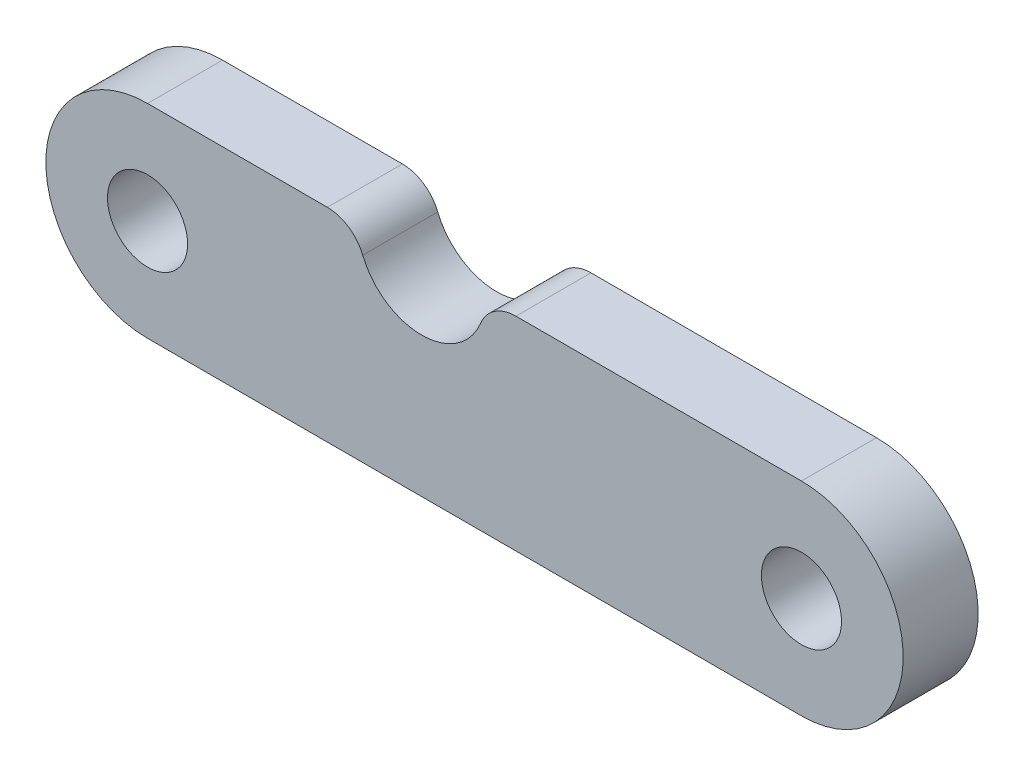
from build123d import *

# Parameters (mm, degrees)
SKETCH1_R           = 3.15
BOSS_EXTRUDE1_DEPTH = 5.9
FILLET1_R           = 3


with BuildPart() as part:
    # Sketch1 → Boss-Extrude1 (new body)
    with BuildSketch(Plane.XY):
        with BuildLine():
            Line((25.7175, -8), (-25.7175, -8))
            ThreePointArc((-25.7175, -8), (-33.7175, 0), (-25.7175, 8))
            Line((-25.7175, 8), (-9.155600281, 8))
            ThreePointArc((-9.155600281, 8), (-4.155600281, 3), (0.844399719, 8))
            Line((0.844399719, 8), (25.7175, 8))
            ThreePointArc((25.7175, 8), (33.7175, 0), (25.7175, -8))
        make_face()
        with Locations((25.7175, 0)):
            Circle(SKETCH1_R, mode=Mode.SUBTRACT)
        with Locations((-25.7175, 0)):
            Circle(SKETCH1_R, mode=Mode.SUBTRACT)
    extrude(amount=BOSS_EXTRUDE1_DEPTH)

    # Fillet1
    fillet1_edges = [part.edges().sort_by_distance(p)[0] for p in [
        (-9.155600281, 8, 2.95),
        (0.844399719, 8, 2.95),
    ]]
    fillet(fillet1_edges, radius=FILLET1_R)


solid = part.part
